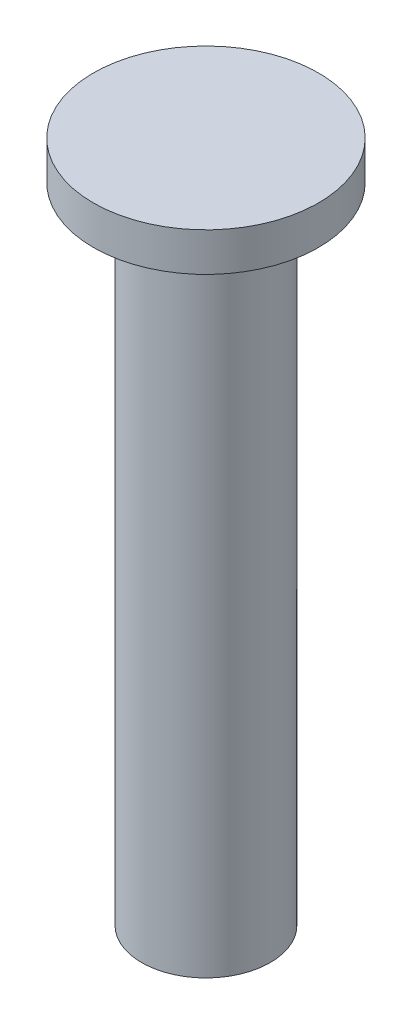
from build123d import *

# Parameters (mm, degrees)
SKETCH_1_R      = 3.5
EXTRUDE_1_DEPTH = 1.2
SKETCH_2_R      = 2
EXTRUDE_2_DEPTH = 20


with BuildPart() as part:
    # 草图1 → 凸台-拉伸1 (new body)
    with BuildSketch(Plane(origin=(0, 0, 0), x_dir=(1, 0, 0), z_dir=(0, 1, 0))):
        with Locations(Location((0, 0, 0), (0, 0, 270))):
            Circle(SKETCH_1_R)
    extrude(amount=EXTRUDE_1_DEPTH)

    # 草图2 → 凸台-拉伸2 (add)
    with BuildSketch(Plane.XZ):
        with Locations(Location((0, 0, 0), (0, 0, 270))):
            Circle(SKETCH_2_R)
    extrude(amount=EXTRUDE_2_DEPTH)


solid = part.part
